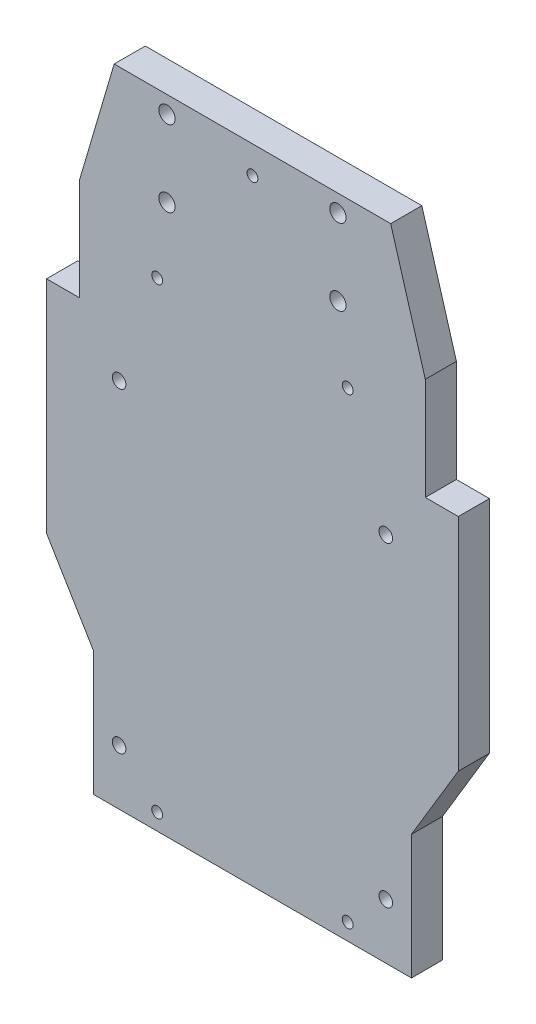
from build123d import *

# Parameters (mm, degrees)
BOSS_EXTRUDE1_DEPTH = 5.715
SKETCH3_R           = 1.25
SKETCH3_R_2         = 1
SKETCH3_R_3         = 1.5
CUT_EXTRUDE1_DEPTH  = 5.715


with BuildPart() as part:
    # Sketch1 → Boss-Extrude1 (new body)
    with BuildSketch(Plane.XY):
        Polygon((-37.8206, -20.2565), (-37.8206, 20.2565), (-31.75, 20.2565), (-31.75, 39.0525), (-25.4, 60.6425), (25.4, 60.6425), (31.75, 39.0525), (31.75, 20.2565), (37.8206, 20.2565), (37.8206, -20.2565), (29.21, -34.6075), (29.21, -57.4675), (-29.21, -57.4675), (-29.21, -34.6075), align=None)
    extrude(amount=BOSS_EXTRUDE1_DEPTH)

    # Sketch3 → Cut-Extrude1 (cut)
    with BuildSketch(Plane.XY.offset(5.715)):
        with Locations((-24.5, 10.6925)):
            Circle(SKETCH3_R)
        with Locations((24.5, 10.6925)):
            Circle(SKETCH3_R)
        with Locations((-24.5, -47.3075)):
            Circle(SKETCH3_R)
        with Locations((24.5, -47.3075)):
            Circle(SKETCH3_R)
        with Locations((0, 55.5625)):
            Circle(SKETCH3_R_2)
        with Locations((17.5, 30.5625)):
            Circle(SKETCH3_R_2)
        with Locations((-17.5, 30.5625)):
            Circle(SKETCH3_R_2)
        with Locations((-17.5, -54.4375)):
            Circle(SKETCH3_R_2)
        with Locations((17.5, -54.4375)):
            Circle(SKETCH3_R_2)
        with Locations((-15.7, 57.48249997)):
            Circle(SKETCH3_R_3)
        with Locations((15.7, 57.48249997)):
            Circle(SKETCH3_R_3)
        with Locations((15.7, 43.48249997)):
            Circle(SKETCH3_R_3)
        with Locations((-15.7, 43.48249997)):
            Circle(SKETCH3_R_3)
    extrude(amount=-CUT_EXTRUDE1_DEPTH, mode=Mode.SUBTRACT)


solid = part.part
